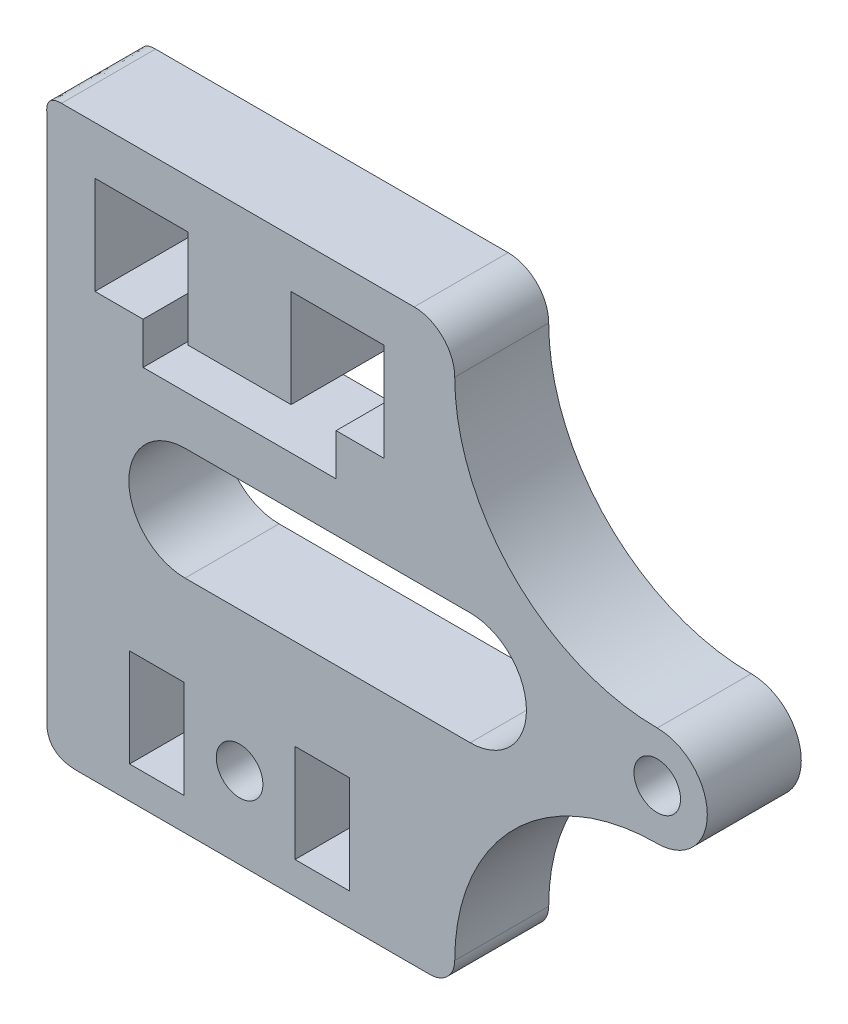
from build123d import *

# Parameters (mm, degrees)
SKETCH1_R           = 1.45
SKETCH1_W           = 3.400011
SKETCH1_H           = 6.1
BOSS_EXTRUDE2_DEPTH = 5.85


with BuildPart() as part:
    # Sketch1 → Boss-Extrude2 (new body)
    with BuildSketch(Plane.XY):
        with BuildLine():
            Line((388.472923735, 562.888903138), (410.424633118, 562.888903138))
            ThreePointArc((410.424633118, 562.888903138), (412.211329852, 562.148829119), (412.95140387, 560.362132386))
            ThreePointArc((412.95140387, 560.362132386), (416.644097047, 551.447182437), (425.559046996, 547.75448926))
            ThreePointArc((425.559046996, 547.75448926), (428.674633119, 544.638903138), (425.559046996, 541.523317015))
            ThreePointArc((425.559046996, 541.523317015), (416.644097047, 537.830623838), (412.95140387, 528.915673889))
            ThreePointArc((412.95140387, 528.915673889), (412.50422307, 527.836083937), (411.424633118, 527.388903138))
            Line((411.424633118, 527.388903138), (389.472923735, 527.388903138))
            add(Edge.make_bspline(
                [(387.555122745, 529.304742909), (387.449571593, 527.388903138), (389.472923735, 527.388903138)],
                knots=[0, 0, 0, 1, 1, 1], degree=2))
            Line((387.555122745, 529.304742909), (387.555122745, 561.972040272))
            add(Edge.make_bspline(
                [(387.555122745, 561.972040272), (387.504608679, 562.888903138), (388.472923735, 562.888903138)],
                knots=[0, 0, 0, 1, 1, 1], degree=2))
        make_face()
        with Locations((425.559046996, 544.638903138)):
            Circle(SKETCH1_R, mode=Mode.SUBTRACT)
        with Locations((399.559046996, 532.438903138)):
            Circle(SKETCH1_R, mode=Mode.SUBTRACT)
        Polygon((405.566920996, 551.188903138), (405.566920996, 553.788903138), (408.562971247, 553.788903138), (408.562971247, 559.888903138), (402.762971247, 559.888903138), (402.762971247, 553.788903138), (396.355122745, 553.788903138), (396.355122745, 559.888903138), (390.555122745, 559.888903138), (390.555122745, 553.788903138), (393.551172996, 553.788903138), (393.551172996, 551.188903138), align=None, mode=Mode.SUBTRACT)
        with Locations((394.409041496, 532.438903138)):
            Rectangle(SKETCH1_W, SKETCH1_H, mode=Mode.SUBTRACT)
        with Locations((404.709052496, 532.438903138)):
            Rectangle(SKETCH1_W, SKETCH1_H, mode=Mode.SUBTRACT)
        with BuildLine():
            Line((396.165690223, 548.138903138), (413.915690223, 548.138903138))
            ThreePointArc((413.915690223, 548.138903138), (417.415690223, 544.638903138), (413.915690223, 541.138903138))
            Line((413.915690223, 541.138903138), (396.165690223, 541.138903138))
            ThreePointArc((396.165690223, 541.138903138), (392.665690223, 544.638903138), (396.165690223, 548.138903138))
        make_face(mode=Mode.SUBTRACT)
    extrude(amount=BOSS_EXTRUDE2_DEPTH)


solid = part.part
